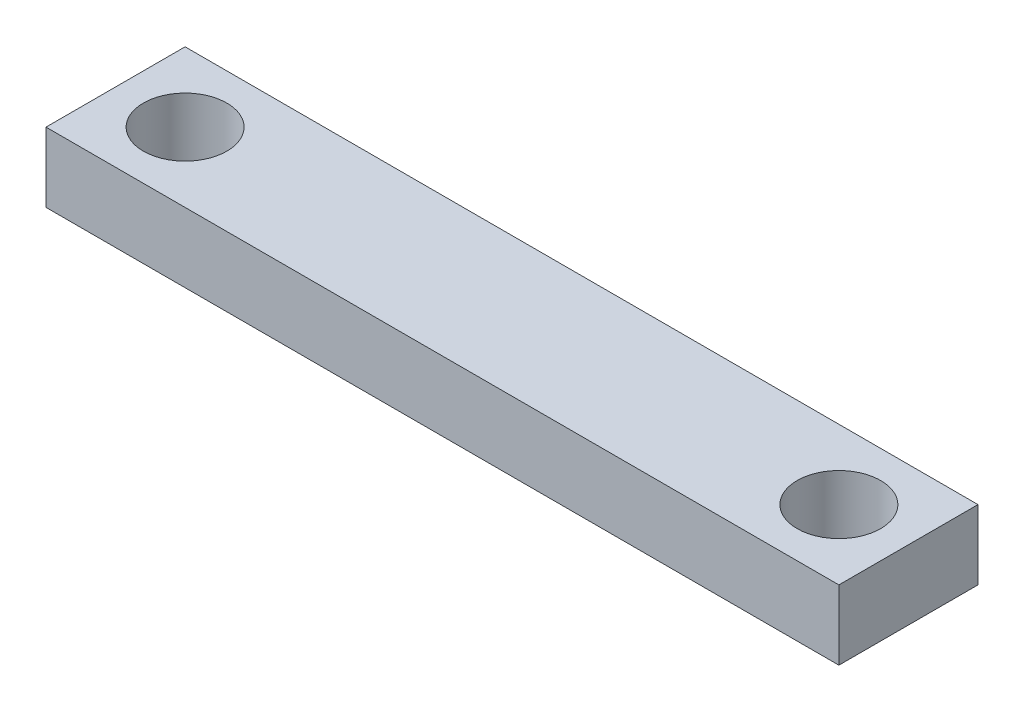
from build123d import *

# Parameters (mm, degrees)
SKETCH1_W           = 57
SKETCH1_H           = 10
SKETCH1_R           = 3
BOSS_EXTRUDE1_DEPTH = 2.5


with BuildPart() as part:
    # Sketch1 → Boss-Extrude1 (new, symmetric)
    with BuildSketch(Plane(origin=(0, 0, 0), x_dir=(1, 0, 0), z_dir=(0, 1, 0))):
        Rectangle(SKETCH1_W, SKETCH1_H)
        with Locations(Location((-23.5, 0, 0), (0, 0, 270))):
            Circle(SKETCH1_R, mode=Mode.SUBTRACT)
        with Locations(Location((23.5, 0, 0), (0, 0, 270))):
            Circle(SKETCH1_R, mode=Mode.SUBTRACT)
    extrude(amount=BOSS_EXTRUDE1_DEPTH, both=True)


solid = part.part
